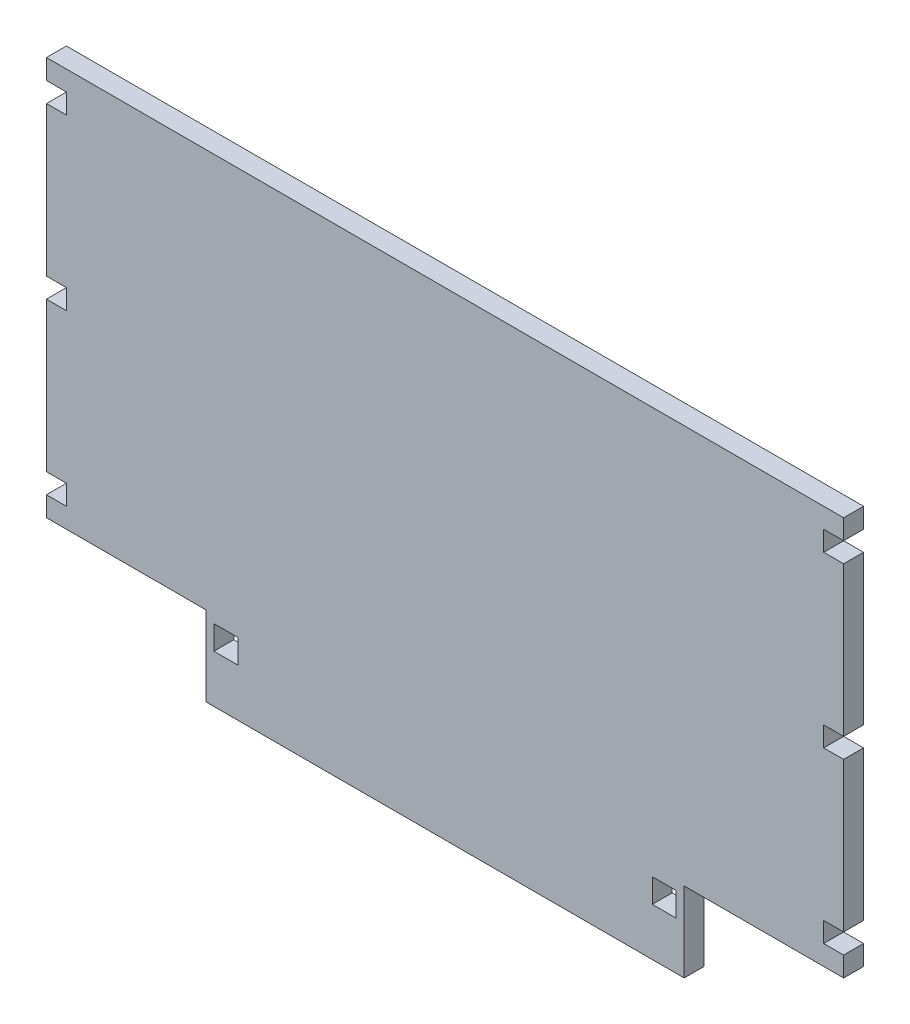
from build123d import *

# Parameters (mm, degrees)
SKETCH2_W           = 6
SKETCH2_H           = 6
BOSS_EXTRUDE1_DEPTH = 5
SKETCH3_W           = 200
SKETCH3_H           = 20
CUT_EXTRUDE1_DEPTH  = 5
SKETCH4_W           = 5
SKETCH4_H           = 5
CUT_EXTRUDE2_DEPTH  = 5


with BuildPart() as part:
    # Sketch2 → Boss-Extrude1 (new body)
    with BuildSketch(Plane.XY):
        Polygon((-100, 75), (-100, -45), (-60, -45), (-60, -65), (0, -65), (60, -65), (60, -45), (100, -45), (100, 75), align=None)
        with Locations((-55, -50)):
            Rectangle(SKETCH2_W, SKETCH2_H, mode=Mode.SUBTRACT)
        with Locations((55, -50)):
            Rectangle(SKETCH2_W, SKETCH2_H, mode=Mode.SUBTRACT)
    extrude(amount=BOSS_EXTRUDE1_DEPTH)

    # Sketch3 → Cut-Extrude1 (cut)
    with BuildSketch(Plane.XY.offset(5)):
        with Locations((0, 65)):
            Rectangle(SKETCH3_W, SKETCH3_H)
    extrude(amount=-CUT_EXTRUDE1_DEPTH, mode=Mode.SUBTRACT)

    # Sketch4 → Cut-Extrude2 (cut)
    with BuildSketch(Plane(origin=(0, 0, 0), x_dir=(-1, 0, 0), z_dir=(0, 0, -1))):
        with Locations((-97.5, 47.5)):
            Rectangle(SKETCH4_W, SKETCH4_H)
        Polygon((95, 50), (95, 45), (97.5, 45), (100, 45), (100, 50), align=None)
        with Locations((-97.5, 5)):
            Rectangle(SKETCH4_W, SKETCH4_H)
        with Locations((97.5, 5)):
            Rectangle(SKETCH4_W, SKETCH4_H)
        with Locations((-97.5, -37.5)):
            Rectangle(SKETCH4_W, SKETCH4_H)
        Polygon((100, -40), (100, -35), (95, -35), (95, -40), (97.5, -40), align=None)
    extrude(amount=-CUT_EXTRUDE2_DEPTH, mode=Mode.SUBTRACT)


solid = part.part
